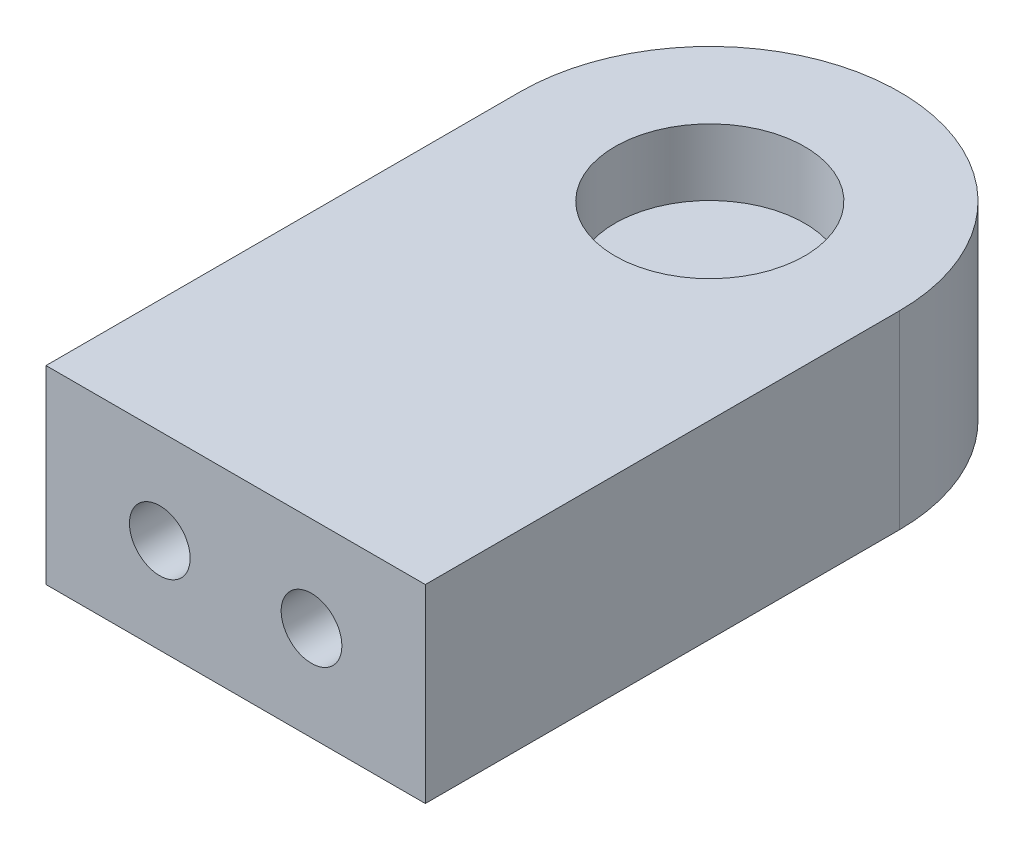
from build123d import *

# Parameters (mm, degrees)
EXTRUDE_1_DEPTH     = 10
SKETCH_2_R          = 5
CUT_EXTRUDE_1_DEPTH = 3.5
CUT_EXTRUDE_START   = -3.5
SKETCH_3_R          = 5
CUT_EXTRUDE_2_DEPTH = 3.5
SKETCH_4_R          = 1.6
CUT_EXTRUDE_3_DEPTH = 10


with BuildPart() as part:
    # 草图1 → 凸台-拉伸1 (new body)
    with BuildSketch(Plane(origin=(0, 0, 0), x_dir=(1, 0, 0), z_dir=(0, 1, 0))):
        with BuildLine():
            Line((0, 0), (0, 25))
            ThreePointArc((0, 25), (10, 35), (20, 25))
            Line((20, 25), (20, 0))
            Line((20, 0), (0, 0))
        make_face()
    extrude(amount=EXTRUDE_1_DEPTH)

    # 草图2 → 切除-拉伸1 (cut)
    with BuildSketch(Plane(origin=(0, 0, 0), x_dir=(1, 0, 0), z_dir=(0, 1, 0))):
        with Locations(Location((10, 25, 0), (0, 0, 270))):
            Circle(SKETCH_2_R)
    extrude(amount=CUT_EXTRUDE_1_DEPTH, mode=Mode.SUBTRACT)

    # 草图3 → 切除-拉伸2 (cut)
    with BuildSketch(Plane(origin=(0, 10, 0), x_dir=(1, 0, 0), z_dir=(0, 1, 0)).offset(CUT_EXTRUDE_START)):
        with Locations(Location((10, 25, 0), (0, 0, 270))):
            Circle(SKETCH_3_R)
    extrude(amount=CUT_EXTRUDE_2_DEPTH, mode=Mode.SUBTRACT)

    # 草图4 → 切除-拉伸3 (cut)
    with BuildSketch(Plane.XY):
        with Locations((6, 5)):
            Circle(SKETCH_4_R)
        with Locations((14, 5)):
            Circle(SKETCH_4_R)
    extrude(amount=-CUT_EXTRUDE_3_DEPTH, mode=Mode.SUBTRACT)


solid = part.part
